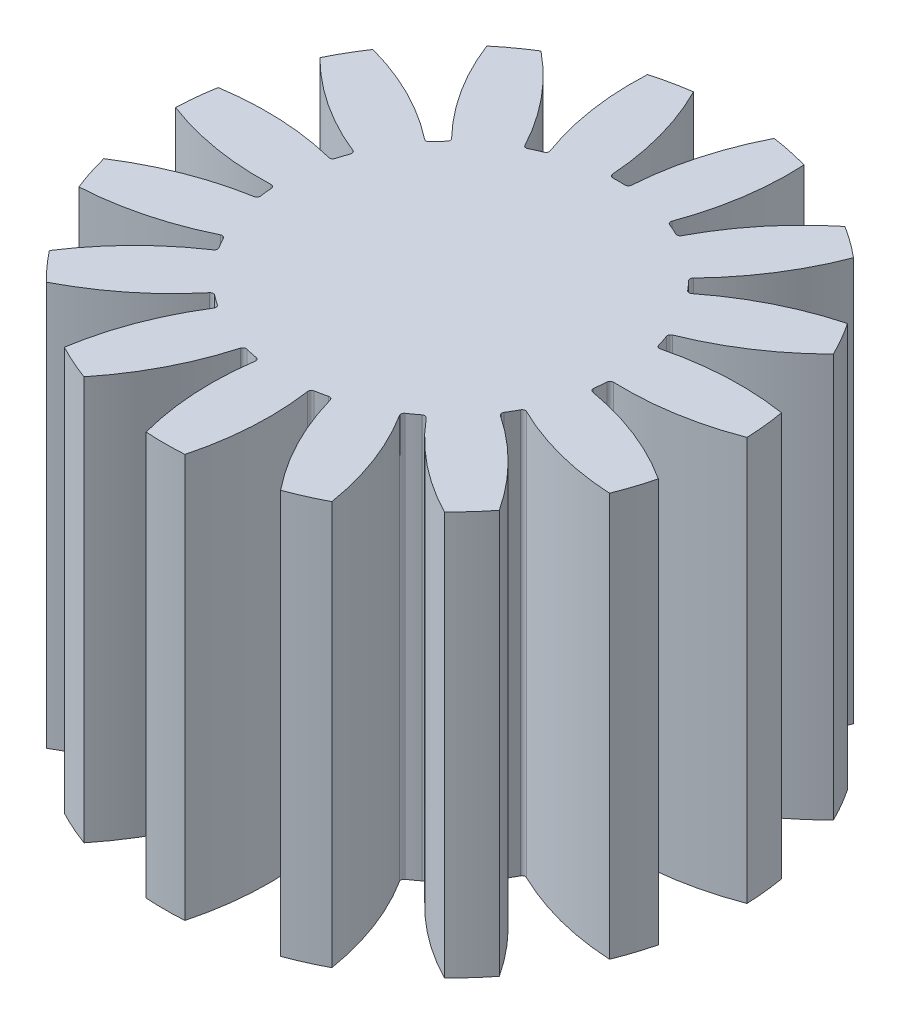
from build123d import *

# Parameters (mm, degrees)
SKETCH_1_R                       = 8.5
EXTRUDE_1_DEPTH                  = 12
CUT_EXTRUDE_1_DEPTH              = 17.985287751
FILLET_1_R                       = 0.1
PATTERN_CIRCULAR_3_COUNT         = 15
FILLET_1_OF_PATTERN_CIRCULAR_3_R = 0.1


with BuildPart() as part:
    # Эскиз1 → Бобышка-Вытянуть1 (new body)
    with BuildSketch(Plane(origin=(0, 0, 0), x_dir=(1, 0, 0), z_dir=(0, 1, 0))):
        with Locations(Location((0, 0, 0), (0, 0, 270))):
            Circle(SKETCH_1_R)
    extrude(amount=EXTRUDE_1_DEPTH)

    # Эскиз3 → Вырез-Вытянуть1 (cut, through all)
    with BuildSketch(Plane(origin=(0, 12, 0), x_dir=(1, 0, 0), z_dir=(0, 1, 0))):
        with BuildLine():
            ThreePointArc((-1.743333257, 9.338671702), (-0.715935558, 7.264828728), (-0.277935666, 4.9922692))
            ThreePointArc((-0.277935666, 4.9922692), (0, 5), (0.277935666, 4.9922692))
            ThreePointArc((0.277935666, 4.9922692), (0.715935558, 7.264828728), (1.743333257, 9.338671702))
            ThreePointArc((1.743333257, 9.338671702), (0, 9.5), (-1.743333257, 9.338671702))
        make_face()
    cut_extrude_1 = extrude(amount=-CUT_EXTRUDE_1_DEPTH, mode=Mode.SUBTRACT)

    # Скругление1
    fillet_1_edges = [part.edges().sort_by_distance(p)[0] for p in [
        (-0.277935666, 6, -4.9922692),
        (0.277935666, 6, -4.9922692),
    ]]
    fillet(fillet_1_edges, radius=FILLET_1_R)

    # Круговой массив3: Вырез-Вытянуть1 ×15 about axis
    pattern_circular_3_axis = Axis((0, 0, 0), (0, 1, 0))
    for i in range(1, PATTERN_CIRCULAR_3_COUNT):
        add(cut_extrude_1.rotate(pattern_circular_3_axis, i * 360 / PATTERN_CIRCULAR_3_COUNT), mode=Mode.SUBTRACT)

    # Скругление1 of Круговой массив3
    fillet_1_of_pattern_circular_3_edges = [part.edges().sort_by_distance(p)[0] for p in [
        (-2.284445681, 6, -4.447618231),
        (-1.776631951, 6, -4.673711471),
        (-3.895954284, 6, -3.133933665),
        (-3.524003763, 6, -3.547026569),
        (-4.833816998, 6, -1.278363497),
        (-4.66204331, 6, -1.807028549),
        (-4.935868839, 6, 0.798247333),
        (-4.993973215, 6, 0.245421123),
        (-4.184464117, 6, 2.736833947),
        (-4.462399783, 6, 2.255435253),
        (-2.709527534, 6, 4.202197109),
        (-3.159236888, 6, 3.875464138),
        (-0.766089026, 6, 4.940962214),
        (-1.309813235, 6, 4.825390066),
        (1.309813235, 6, 4.825390066),
        (0.766089026, 6, 4.940962214),
        (3.159236888, 6, 3.875464138),
        (2.709527534, 6, 4.202197109),
        (4.462399783, 6, 2.255435253),
        (4.184464117, 6, 2.736833947),
        (4.993973215, 6, 0.245421123),
        (4.935868839, 6, 0.798247333),
        (4.66204331, 6, -1.807028549),
        (4.833816998, 6, -1.278363497),
        (3.524003763, 6, -3.547026569),
        (3.895954284, 6, -3.133933665),
        (1.776631951, 6, -4.673711471),
        (2.284445681, 6, -4.447618231),
    ]]
    fillet(fillet_1_of_pattern_circular_3_edges, radius=FILLET_1_OF_PATTERN_CIRCULAR_3_R)


solid = part.part
